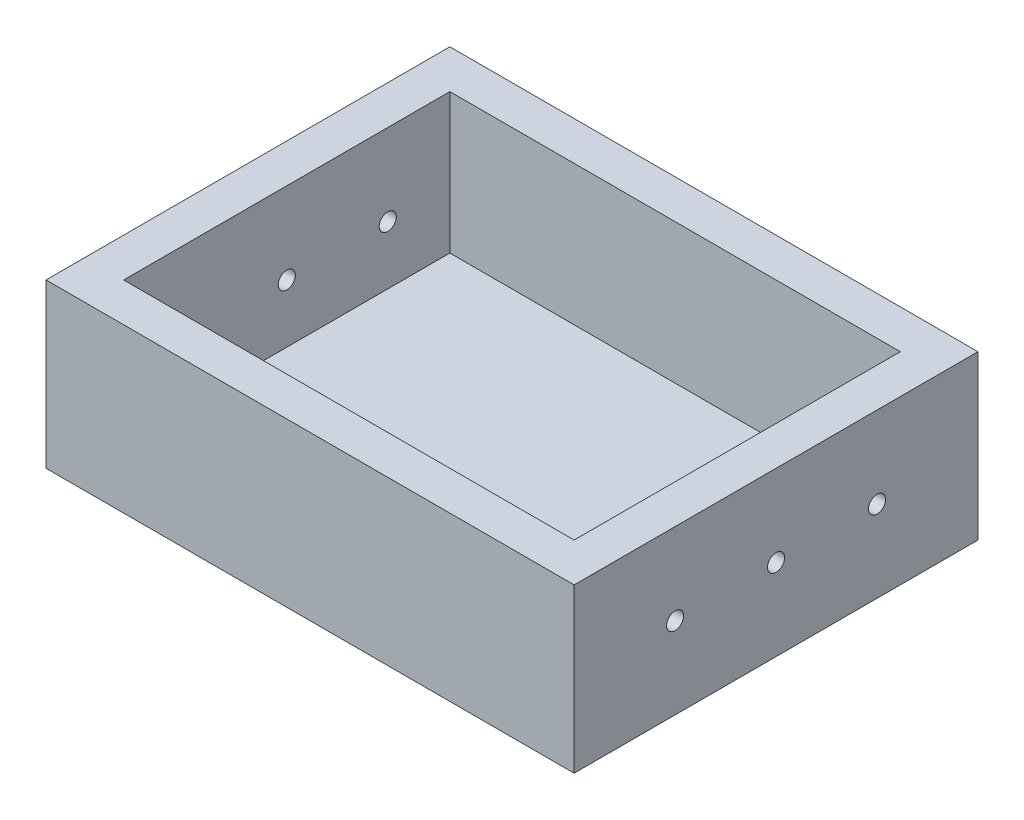
from build123d import *

# Parameters (mm, degrees)
SKETCH_1_W          = 136
SKETCH_1_H          = 104
EXTRUDE_1_DEPTH     = 42
SKETCH_2_W          = 116
SKETCH_2_H          = 84
CUT_EXTRUDE_1_DEPTH = 36
SKETCH_6_R          = 2.2
CUT_EXTRUDE_5_DEPTH = 136


with BuildPart() as part:
    # 草图1 → 凸台-拉伸1 (new body)
    with BuildSketch(Plane(origin=(0, 0, 0), x_dir=(1, 0, 0), z_dir=(0, 1, 0))):
        Rectangle(SKETCH_1_W, SKETCH_1_H)
    extrude(amount=EXTRUDE_1_DEPTH)

    # 草图2 → 切除-拉伸1 (cut)
    with BuildSketch(Plane(origin=(0, 42, 0), x_dir=(1, 0, 0), z_dir=(0, 1, 0))):
        Rectangle(SKETCH_2_W, SKETCH_2_H)
    extrude(amount=-CUT_EXTRUDE_1_DEPTH, mode=Mode.SUBTRACT)

    # 草图6 → 切除-拉伸5 (cut)
    with BuildSketch(Plane.ZY.offset(68)):
        with Locations((-26, 21)):
            Circle(SKETCH_6_R)
        with Locations((26, 21)):
            Circle(SKETCH_6_R)
        with Locations((0, 21)):
            Circle(SKETCH_6_R)
    extrude(amount=-CUT_EXTRUDE_5_DEPTH, mode=Mode.SUBTRACT)


solid = part.part
